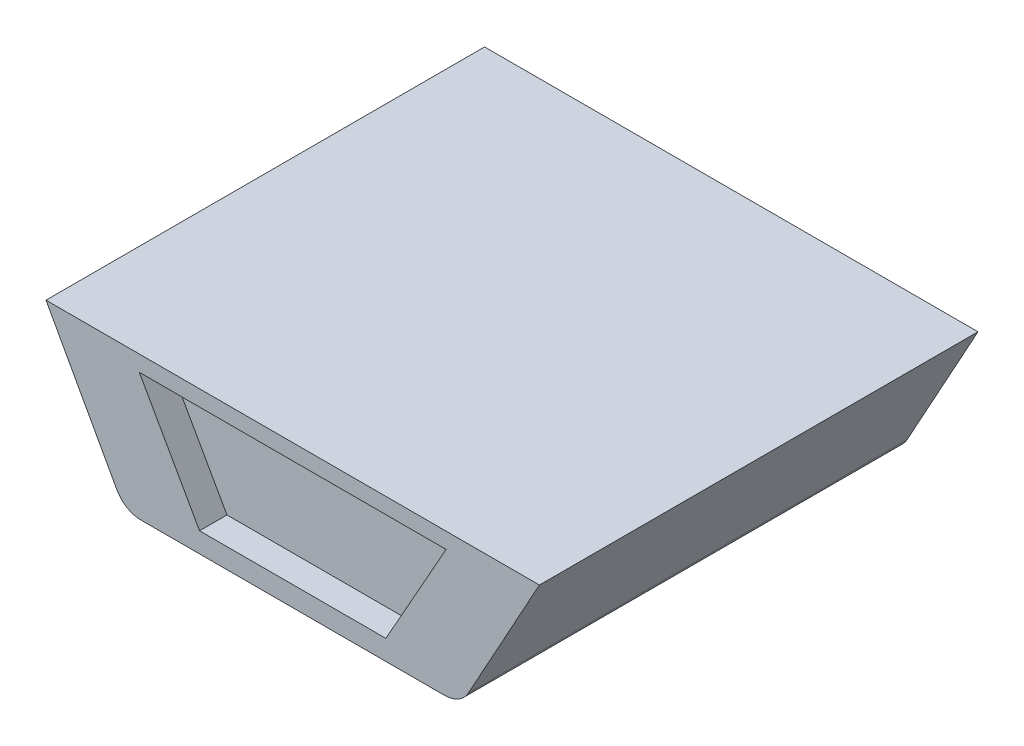
from build123d import *

# Parameters (mm, degrees)
BOSS_EXTRUDE1_DEPTH = 203.2
CUT_EXTRUDE1_DEPTH  = 12.7
CUT_EXTRUDE2_DEPTH  = 12.7
FILLET3_R           = 12.7


with BuildPart() as part:
    # Sketch1 → Boss-Extrude1 (new body)
    with BuildSketch(Plane.XY):
        Polygon((-114.3, 41.748133631), (-77.843883309, -24.500078422), (77.843883309, -24.500078422), (114.3, 41.748133631), align=None)
    extrude(amount=BOSS_EXTRUDE1_DEPTH)

    # Sketch2 → Cut-Extrude1 (cut)
    with BuildSketch(Plane(origin=(0, 0, 0), x_dir=(-1, 0, 0), z_dir=(0, 0, -1))):
        Polygon((61.610965664, 33.637347898), (-61.610965664, 33.637347898), (-40.398919629, -12.294528868), (40.398919629, -12.294528868), align=None)
    extrude(amount=-CUT_EXTRUDE1_DEPTH, mode=Mode.SUBTRACT)

    # Sketch3 → Cut-Extrude2 (cut)
    with BuildSketch(Plane.XY.offset(203.2)):
        Polygon((71.075916858, 34.413325386), (-71.075916858, 34.413325386), (-43.162708171, -15.225650552), (43.162708171, -15.225650552), align=None)
    extrude(amount=-CUT_EXTRUDE2_DEPTH, mode=Mode.SUBTRACT)

    # Fillet3
    fillet3_edges = [part.edges().sort_by_distance(p)[0] for p in [
        (-77.843883309, -24.500078422, 101.6),
        (77.843883309, -24.500078422, 101.6),
    ]]
    fillet(fillet3_edges, radius=FILLET3_R)


solid = part.part
